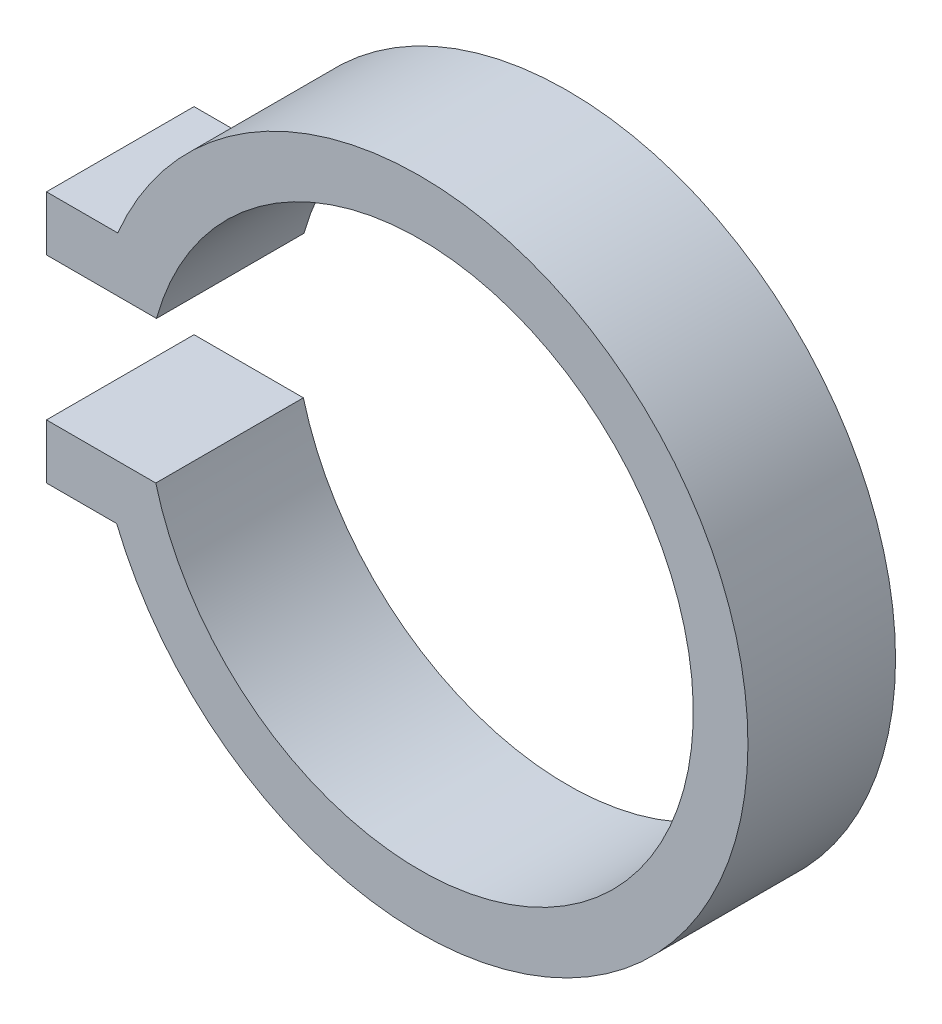
from build123d import *

# Parameters (mm, degrees)
BOSS_EXTRUDE1_DEPTH = 27


with BuildPart() as part:
    # Sketch1 → Boss-Extrude1 (new body)
    with BuildSketch(Plane.XY):
        with BuildLine():
            Line((-55.289417574, 23.304083425), (-68.326285262, 23.304083425))
            Line((-68.326285262, 23.304083425), (-68.326285262, 13.304083425))
            Line((-68.326285262, 13.304083425), (-48.197524461, 13.304083425))
            ThreePointArc((-48.197524461, 13.304083425), (49.999393075, -0.246357747), (-48.326285262, -12.828489886))
            Line((-48.326285262, -12.828489886), (-68.326285262, -12.828489886))
            Line((-68.326285262, -12.828489886), (-68.326285262, -22.828489886))
            Line((-68.326285262, -22.828489886), (-55.487476511, -22.828489886))
            ThreePointArc((-55.487476511, -22.828489886), (59.999447046, -0.257592972), (-55.289417574, 23.304083425))
        make_face()
    extrude(amount=BOSS_EXTRUDE1_DEPTH)


solid = part.part
